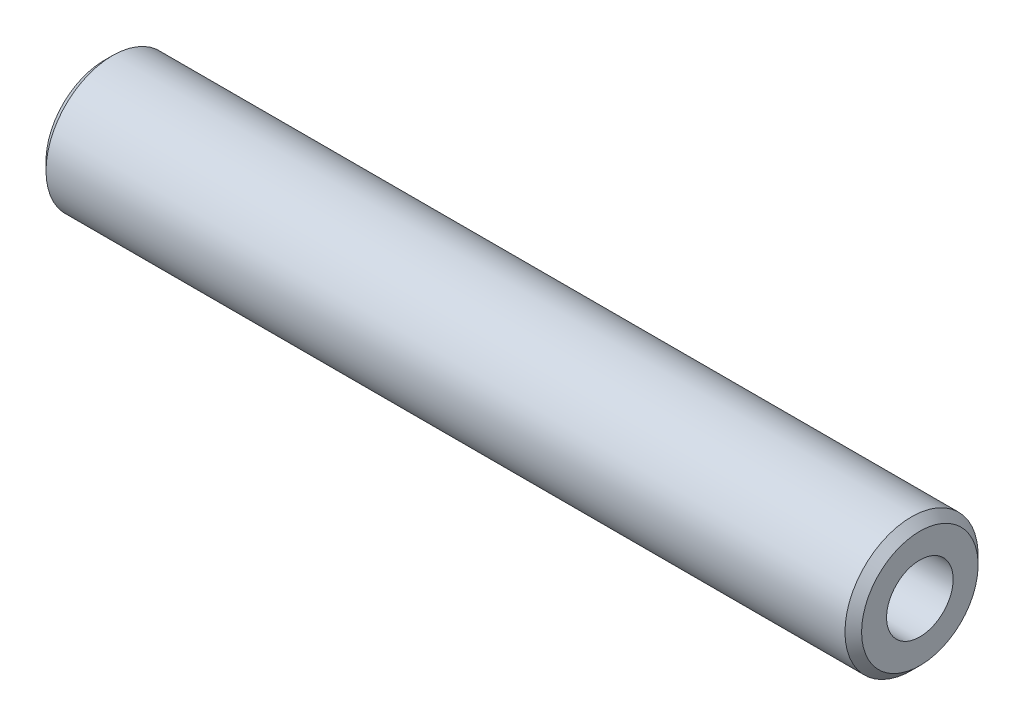
from build123d import *

# Parameters (mm, degrees)
SKETCH_1_W                     = 49
SKETCH_1_H                     = 4
M4X0_7_1_D                     = 3.3
M4X0_7_1_DEPTH                 = 11.5
M4X0_7_1_CBORE_D               = 4
M4X0_7_1_CBORE_DEPTH           = 8
M4X0_7_1_TIP                   = 0.991420021
M4X0_7_1_ON_FACE_2_D           = 3.3
M4X0_7_1_ON_FACE_2_DEPTH       = 11.5
M4X0_7_1_ON_FACE_2_CBORE_D     = 4
M4X0_7_1_ON_FACE_2_CBORE_DEPTH = 8
M4X0_7_1_ON_FACE_2_TIP         = 0.991420021
CHAMFER_1_SIZE                 = 0.5


with BuildPart() as part:
    # ｽｹｯﾁ1 → 回転1 (revolve)
    with BuildSketch(Plane.XY, mode=Mode.PRIVATE) as revolve_1_sk:
        with Locations((0, 2)):
            Rectangle(SKETCH_1_W, SKETCH_1_H)
    revolve(revolve_1_sk.sketch.rotate(Axis((0, 0, 0), (1, 0, 0)), 90), axis=Axis((0, 0, 0), (1, 0, 0)))

    # M4x0.7 ねじ穴1
    with Locations(Plane(origin=(24.5, 0, 0), x_dir=(0, 0, 1), z_dir=(1, 0, 0))):
        with Locations((0, 0)):
            CounterBoreHole(M4X0_7_1_D / 2, M4X0_7_1_CBORE_D / 2, M4X0_7_1_CBORE_DEPTH, depth=M4X0_7_1_DEPTH)
            with Locations((0, 0, -(M4X0_7_1_DEPTH + M4X0_7_1_TIP / 2))):  # 118° drill point
                Cone(0, M4X0_7_1_D / 2, M4X0_7_1_TIP, mode=Mode.SUBTRACT)

    # M4x0.7 ねじ穴1 on face 2
    with Locations(Plane(origin=(-24.5, 0, 0), x_dir=(0, 0, -1), z_dir=(-1, 0, 0))):
        with Locations((0, 0)):
            CounterBoreHole(M4X0_7_1_ON_FACE_2_D / 2, M4X0_7_1_ON_FACE_2_CBORE_D / 2, M4X0_7_1_ON_FACE_2_CBORE_DEPTH, depth=M4X0_7_1_ON_FACE_2_DEPTH)
            with Locations((0, 0, -(M4X0_7_1_ON_FACE_2_DEPTH + M4X0_7_1_ON_FACE_2_TIP / 2))):  # 118° drill point
                Cone(0, M4X0_7_1_ON_FACE_2_D / 2, M4X0_7_1_ON_FACE_2_TIP, mode=Mode.SUBTRACT)

    # 面取り1
    chamfer_1_edges = [part.edges().sort_by_distance(p)[0] for p in [
        (24.5, 0, -4),
        (-24.5, 0, -4),
    ]]
    chamfer(chamfer_1_edges, length=CHAMFER_1_SIZE)


solid = part.part
